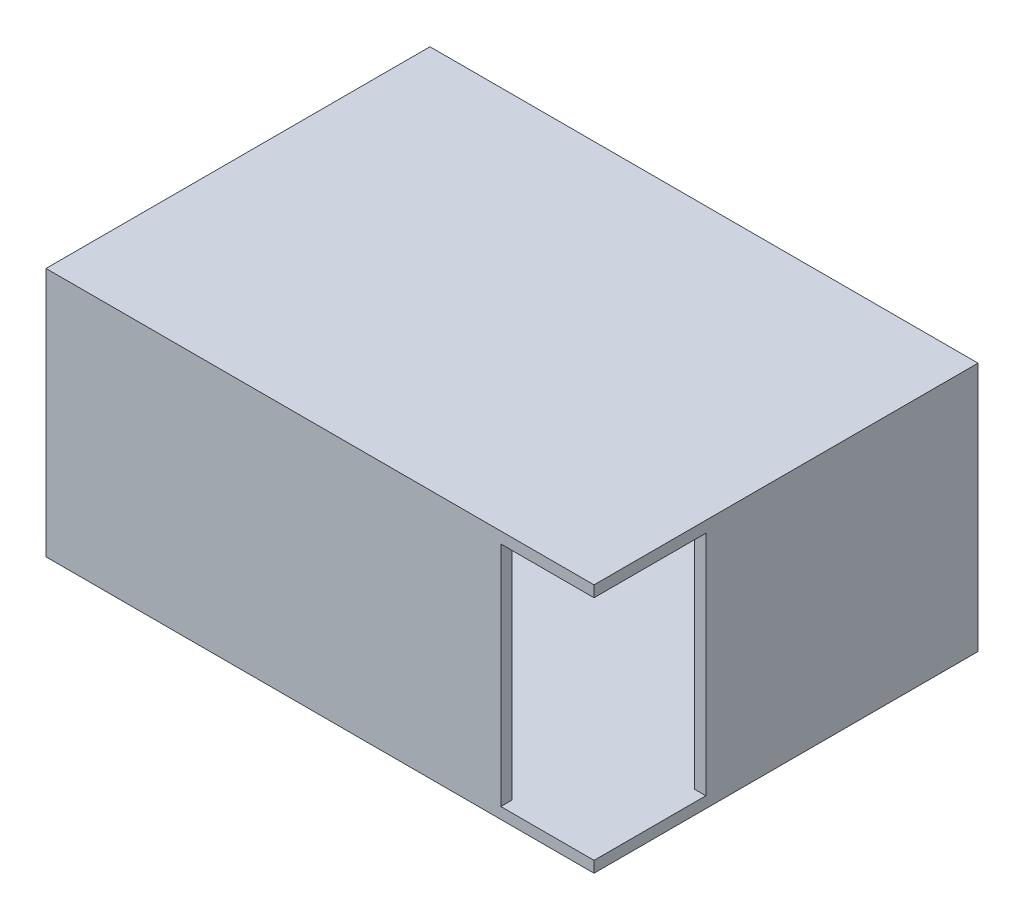
from build123d import *

# Parameters (mm, degrees)
SKETCH1_W           = 85.09
SKETCH1_H           = 130.81
BOSS_EXTRUDE1_DEPTH = 186.69
SKETCH3_W           = 77.47
SKETCH3_H           = 38.1
CUT_EXTRUDE3_DEPTH  = 31.75
SKETCH4_W           = 179.07
SKETCH4_H           = 77.47
CUT_EXTRUDE4_DEPTH  = 127


with BuildPart() as part:
    # Sketch1 → Boss-Extrude1 (new body)
    with BuildSketch(Plane.YZ):
        with Locations((42.545, 65.405)):
            Rectangle(SKETCH1_W, SKETCH1_H)
    extrude(amount=BOSS_EXTRUDE1_DEPTH)

    # Sketch3 → Cut-Extrude3 (cut)
    with BuildSketch(Plane.YZ.offset(186.69)):
        with Locations((42.545, 111.76)):
            Rectangle(SKETCH3_W, SKETCH3_H)
    extrude(amount=-CUT_EXTRUDE3_DEPTH, mode=Mode.SUBTRACT)

    # Sketch4 → Cut-Extrude4 (cut)
    with BuildSketch(Plane(origin=(0, 0, 0), x_dir=(1, 0, 0), z_dir=(0, 0, -1))):
        with Locations((93.345, -42.545)):
            Rectangle(SKETCH4_W, SKETCH4_H)
    extrude(amount=-CUT_EXTRUDE4_DEPTH, mode=Mode.SUBTRACT)


solid = part.part
